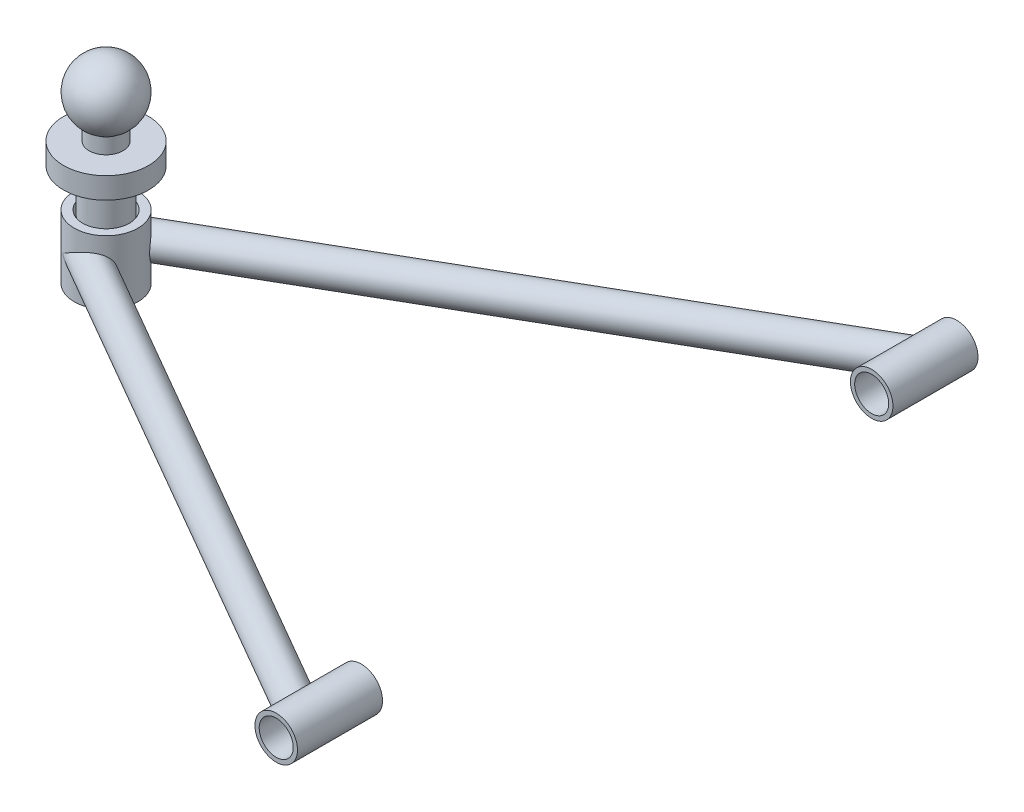
from build123d import *

# Parameters (mm, degrees)
SKETCH_1_R                       = 15
SKETCH_1_R_2                     = 11
EXTRUDE_1_DEPTH                  = 15
EXTRUDE_START                    = 120
SKETCH_3_R                       = 10
SKETCH_3_R_2                     = 8
EXTRUDE_3_DEPTH                  = 40
EXTRUDE_4_REACH                  = 349.195
EXTRUDE_4_END_RADIUS             = 10
EXTRUDE_START_2                  = 50
SKETCH_2_R                       = 7.5
SKETCH_2_R_2                     = 5.5
EXTRUDE_4_DIRECTION_2_REACH      = 349.195
EXTRUDE_4_DIRECTION_2_END_RADIUS = 15


with BuildPart() as part:
    # 草图1 → 凸台-拉伸1 (new, symmetric)
    with BuildSketch(Plane(origin=(0, 0, 0), x_dir=(1, 0, 0), z_dir=(0, 1, 0))):
        with Locations(Location((0, 0, 0), (0, 0, 270))):
            Circle(SKETCH_1_R)
        with Locations(Location((0, 0, 0), (0, 0, 270))):
            Circle(SKETCH_1_R_2, mode=Mode.SUBTRACT)
    extrude(amount=EXTRUDE_1_DEPTH, both=True)



with BuildPart() as body_2:
    # 草图3 → 凸台-拉伸3 (new body)
    with BuildSketch(Plane.XY.offset(EXTRUDE_START)):
        with Locations((240, 0)):
            Circle(SKETCH_3_R)
        with Locations((240, 0)):
            Circle(SKETCH_3_R_2, mode=Mode.SUBTRACT)
    extrude(amount=EXTRUDE_3_DEPTH)


with BuildPart() as part_1:
    add(part.part)

    add(body_2.part)  # 凸台-拉伸4 merges body 2
    # 凸台-拉伸4: up to this cylinder (the profile starts outside it)
    extrude_4_end = Plane(origin=(240, 0, 25.183712), z_dir=(0, 0, -1)) * Cylinder(EXTRUDE_4_END_RADIUS, 719.39, mode=Mode.PRIVATE)
    # 草图2 → 凸台-拉伸4 (add, up to the surface)
    with BuildSketch(Plane(origin=(0, 0, 0), x_dir=(0, -1, 0), z_dir=(0.866025403784438, 0, 0.500000000000001)).offset(EXTRUDE_START_2), mode=Mode.PRIVATE) as extrude_4_sk1:
        with Locations(Location((0, -7.5, 0), (0, 0, 270))):
            Circle(SKETCH_2_R)
        with Locations(Location((0, -7.5, 0), (0, 0, 90))):
            Circle(SKETCH_2_R_2, mode=Mode.SUBTRACT)
    extrude_4_tool1 = extrude(extrude_4_sk1.sketch, amount=EXTRUDE_4_REACH, mode=Mode.PRIVATE) - extrude_4_end
    add(extrude_4_tool1.solids().sort_by_distance((43.195204, 0, 25.183712))[0])

    # 凸台-拉伸4 direction 2: up to this cylinder (the profile starts outside it)
    extrude_4_direction_2_end = Plane(origin=(0, 0, 0), z_dir=(0, -1, 0)) * Cylinder(EXTRUDE_4_DIRECTION_2_END_RADIUS, 729.39, mode=Mode.PRIVATE)
    # 草图2 → 凸台-拉伸4 direction 2 (add, up to the surface)
    with BuildSketch(Plane(origin=(0, 0, 0), x_dir=(0, -1, 0), z_dir=(0.866025403784438, 0, 0.500000000000001)).offset(EXTRUDE_START_2), mode=Mode.PRIVATE) as extrude_4_direction_2_sk1:
        with Locations(Location((0, -7.5, 0), (0, 0, 270))):
            Circle(SKETCH_2_R)
        with Locations(Location((0, -7.5, 0), (0, 0, 90))):
            Circle(SKETCH_2_R_2, mode=Mode.SUBTRACT)
    extrude_4_direction_2_tool1 = extrude(extrude_4_direction_2_sk1.sketch, amount=-EXTRUDE_4_DIRECTION_2_REACH, mode=Mode.PRIVATE) - extrude_4_direction_2_end
    add(extrude_4_direction_2_tool1.solids().sort_by_distance((43.195204, 0, 25.183712))[0])

    # 镜向16: part across plane


with BuildPart() as part_2:
    add(part_1.part)
    add(part_1.part.mirror(Plane.XY))


with BuildPart() as body_2_2:
    # 草图4 → 旋转1 (revolve)
    with BuildSketch(Plane(origin=(0, 0, 0), x_dir=(0, 0, -1), z_dir=(1, 0, 0))):
        with BuildLine():
            Line((-8, 43), (-8, 50.31142246))
            ThreePointArc((-8, 50.31142246), (-14.410563193, 67.163612428), (0, 78))
            Line((0, 78), (0, 13))
            Line((0, 13), (-10, 13))
            Line((-10, 13), (-10, 33))
            Line((-10, 33), (-20, 33))
            Line((-20, 33), (-20, 43))
            Line((-20, 43), (-8, 43))
        make_face()
    revolve(axis=Axis((0, 78, 0), (0, -1, 0)))


solid = Compound([part_2.part, body_2_2.part])
